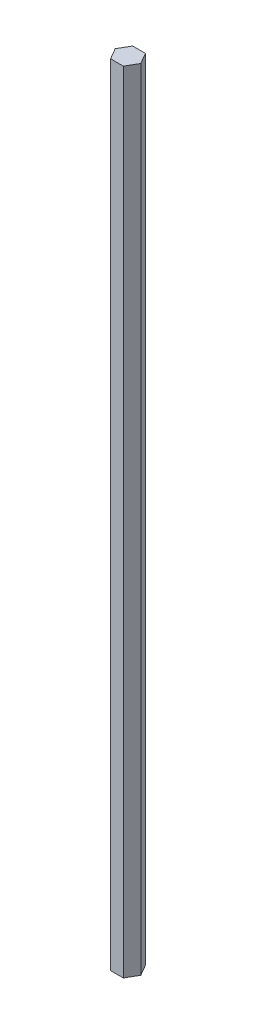
from build123d import *

# Parameters (mm, degrees)
EXTRUDE_1_DEPTH = 250


with BuildPart() as part:
    # 草图1 → 凸台-拉伸1 (new body)
    with BuildSketch(Plane(origin=(0, 0, 0), x_dir=(1, 0, 0), z_dir=(0, 1, 0))):
        Polygon((4.041451884, 0), (2.020725942, 3.5), (-2.020725942, 3.5), (-4.041451884, 0), (-2.020725942, -3.5), (2.020725942, -3.5), align=None)
    extrude(amount=EXTRUDE_1_DEPTH)


solid = part.part
